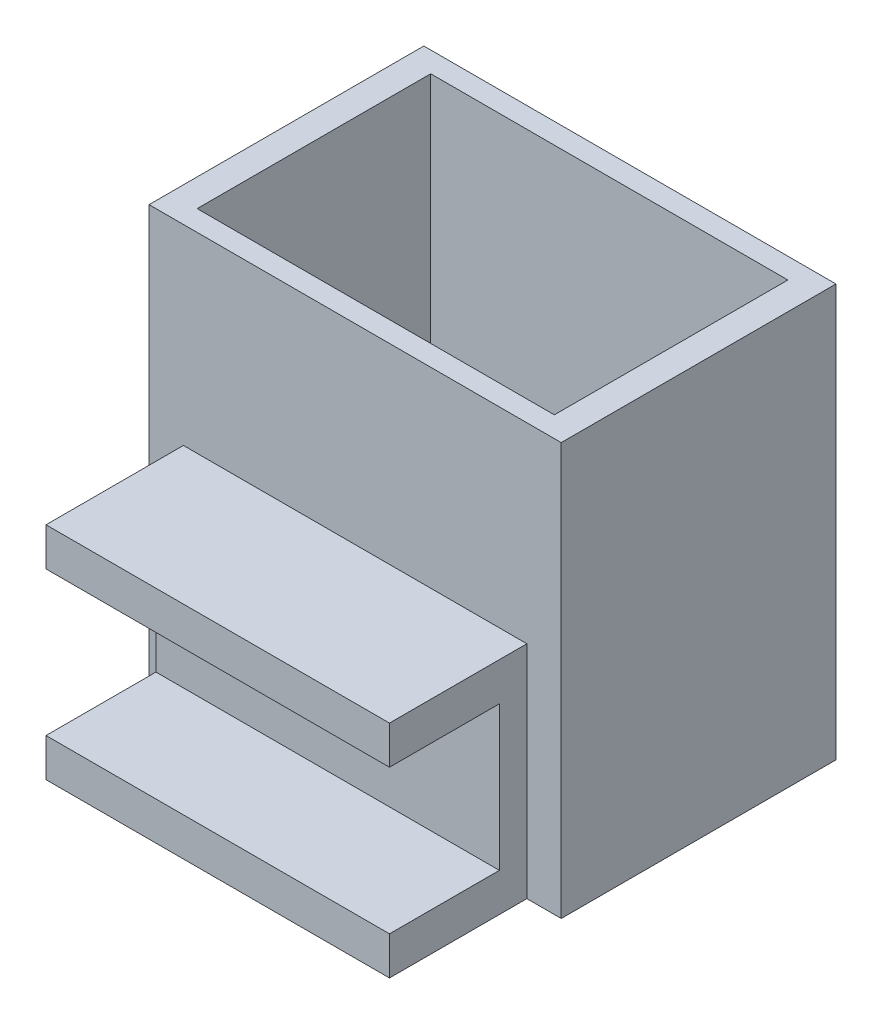
from build123d import *

# Parameters (mm, degrees)
SKETCH_1_W          = 30
SKETCH_1_H          = 20
EXTRUDE_1_DEPTH     = 30
SKETCH_2_W          = 26
SKETCH_2_H          = 17
CUT_EXTRUDE_2_DEPTH = 25
SKETCH_3_W          = 25
SKETCH_3_H          = 16.07
EXTRUDE_2_DEPTH     = 10
SKETCH_4_W          = 8
SKETCH_4_H          = 10.5
CUT_EXTRUDE_3_DEPTH = 45.426074479


with BuildPart() as part:
    # 草图1 → 凸台-拉伸1 (new body)
    with BuildSketch(Plane(origin=(0, 0, 0), x_dir=(1, 0, 0), z_dir=(0, 1, 0))):
        with Locations((-0.371492922, 2.183544304)):
            Rectangle(SKETCH_1_W, SKETCH_1_H)
    extrude(amount=EXTRUDE_1_DEPTH)

    # 草图2 → 切除-拉伸2 (cut)
    with BuildSketch(Plane(origin=(0, 30, 0), x_dir=(1, 0, 0), z_dir=(0, 1, 0))):
        with Locations((-0.371492922, 2.183544304)):
            Rectangle(SKETCH_2_W, SKETCH_2_H)
    extrude(amount=-CUT_EXTRUDE_2_DEPTH, mode=Mode.SUBTRACT)

    # 草图3 → 凸台-拉伸2 (add)
    with BuildSketch(Plane.XY.offset(7.816455696)):
        with Locations((-0.371492922, 8.035)):
            Rectangle(SKETCH_3_W, SKETCH_3_H)
    extrude(amount=EXTRUDE_2_DEPTH)

    # 草图4 → 切除-拉伸3 (cut, through all)
    with BuildSketch(Plane(origin=(12.128507078, 0, 0), x_dir=(0, 0, -1), z_dir=(1, 0, 0))):
        with Locations((-13.816455696, 8.035)):
            Rectangle(SKETCH_4_W, SKETCH_4_H)
    extrude(amount=-CUT_EXTRUDE_3_DEPTH, mode=Mode.SUBTRACT)


solid = part.part
